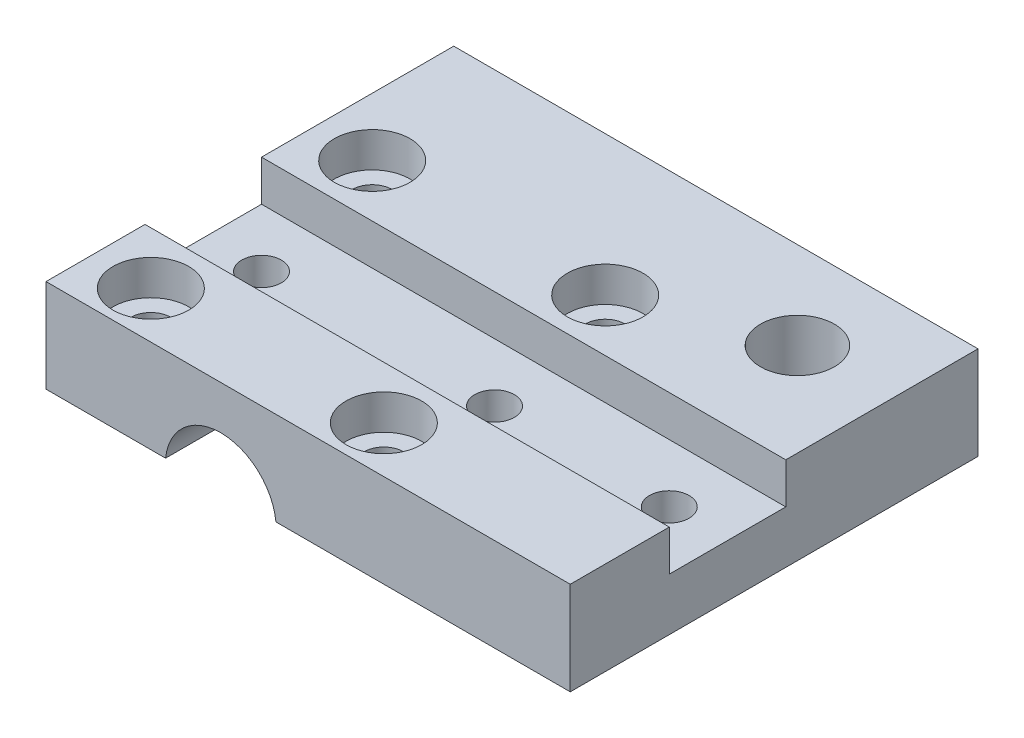
from build123d import *

# Parameters (mm, degrees)
BOSS_EXTRUDE1_DEPTH            = 17.5
CUT_EXTRUDE1_REACH             = 37.641
SKETCH2_R                      = 3.175
SKETCH3_W                      = 45
SKETCH3_H                      = 10
CUT_EXTRUDE_THIN2_DEPTH        = 3.5
CBORE_FOR_M3_SHCS1_D           = 3.4
CBORE_FOR_M3_SHCS1_CBORE_D     = 6.5
CBORE_FOR_M3_SHCS1_CBORE_DEPTH = 3
M3_CLEARANCE_HOLE1_D           = 3.4
SKETCH11_R                     = 4
CUT_EXTRUDE2_DEPTH             = 1


with BuildPart() as part:
    # Sketch1 → Boss-Extrude1 (new, symmetric)
    with BuildSketch(Plane.XY):
        with BuildLine():
            Line((30, 0.5), (30, 5.5))
            Line((30, 5.5), (30, 8.5))
            Line((30, 8.5), (-15, 8.5))
            Line((-15, 8.5), (-15, 0.5))
            Line((-15, 0.5), (-4.736180555, 0.5))
            ThreePointArc((-4.736180555, 0.5), (0, 4.7625), (4.736180555, 0.5))
            Line((4.736180555, 0.5), (30, 0.5))
        make_face()
    extrude(amount=BOSS_EXTRUDE1_DEPTH, both=True)

    # Sketch2 → Cut-Extrude1 (cut, up to next)
    with BuildSketch(Plane(origin=(0, 8.5, 0), x_dir=(1, 0, 0), z_dir=(0, 1, 0)), mode=Mode.PRIVATE) as cut_extrude1_sk1:
        with Locations(Location((22, 10, 0), (0, 0, 270))):
            Circle(SKETCH2_R)
    cut_extrude1_tool1 = extrude(cut_extrude1_sk1.sketch, amount=-CUT_EXTRUDE1_REACH, mode=Mode.PRIVATE) & part.part
    add(cut_extrude1_tool1.solids().sort_by_distance((22, 8.5, -10))[0], mode=Mode.SUBTRACT)

    # Sketch3 → Cut-Extrude-Thin2 (cut)
    with BuildSketch(Plane(origin=(0, 8.5, 0), x_dir=(1, 0, 0), z_dir=(0, 1, 0))):
        with Locations((7.5, -4)):
            Rectangle(SKETCH3_W, SKETCH3_H)
    extrude(amount=-CUT_EXTRUDE_THIN2_DEPTH, mode=Mode.SUBTRACT)

    # CBORE for M3 SHCS1 (through all)
    with Locations(Plane(origin=(0, 8.5, 0), x_dir=(-1, 0, 0), z_dir=(0, 1, 0))):
        with Locations((-10, 13.5), (-10, -5.5), (10, -5.5), (10, 13.5)):
            CounterBoreHole(CBORE_FOR_M3_SHCS1_D / 2, CBORE_FOR_M3_SHCS1_CBORE_D / 2, CBORE_FOR_M3_SHCS1_CBORE_DEPTH)

    # M3 Clearance Hole1 (through all)
    with Locations(Plane(origin=(0, 5, 0), x_dir=(-1, 0, 0), z_dir=(0, 1, 0))):
        with Locations((-10, 4), (-25, 4), (10, 4)):
            Hole(M3_CLEARANCE_HOLE1_D / 2)

    # Sketch11 → Cut-Extrude2 (cut)
    with BuildSketch(Plane.XZ.offset(-0.5)):
        with Locations(Location((-10, 4, 0), (0, 0, 270))):
            Circle(SKETCH11_R)
        with Locations(Location((10, 4, 0), (0, 0, 270))):
            Circle(SKETCH11_R)
        with Locations(Location((25, 4, 0), (0, 0, 270))):
            Circle(SKETCH11_R)
    extrude(amount=-CUT_EXTRUDE2_DEPTH, mode=Mode.SUBTRACT)


solid = part.part
